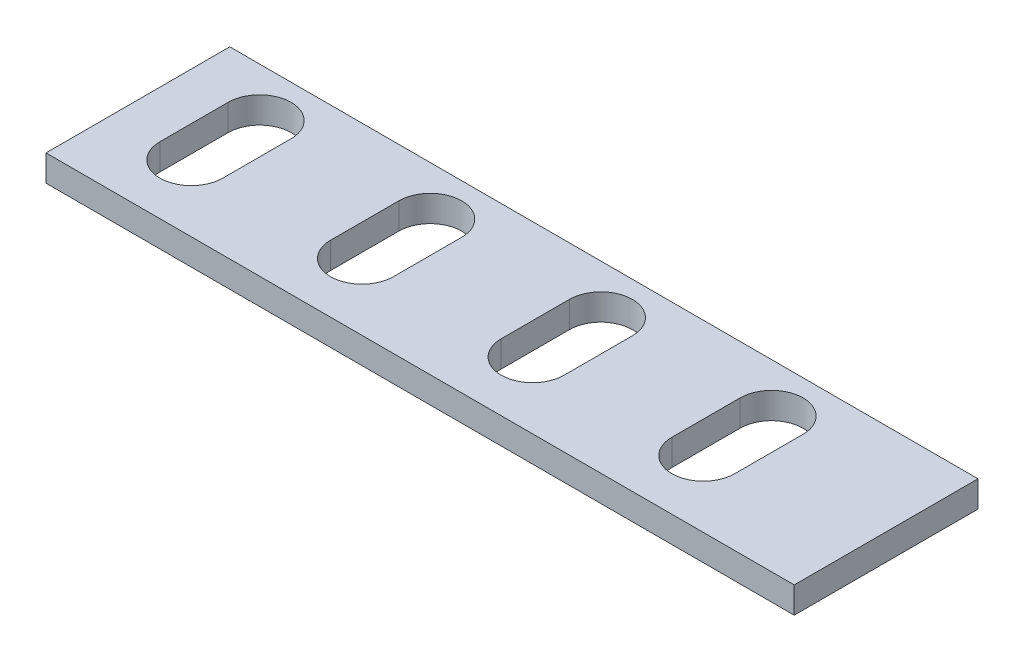
from build123d import *

# Parameters (mm, degrees)
SKETCH1_W           = 570
SKETCH1_H           = 140
BOSS_EXTRUDE1_DEPTH = 20


with BuildPart() as part:
    # Sketch1 → Boss-Extrude1 (new body)
    with BuildSketch(Plane(origin=(0, 0, 0), x_dir=(1, 0, 0), z_dir=(0, 1, 0))):
        with Locations((-36.238685709, 22.089881478)):
            Rectangle(SKETCH1_W, SKETCH1_H)
        with BuildLine():
            Line((-237.238685709, 54.823652517), (-237.238685709, 2.823652517))
            ThreePointArc((-237.238685709, 2.823652517), (-261.238685709, -21.176347483), (-285.238685709, 2.823652517))
            Line((-285.238685709, 2.823652517), (-285.238685709, 54.823652517))
            ThreePointArc((-285.238685709, 54.823652517), (-261.238685709, 78.823652517), (-237.238685709, 54.823652517))
        make_face(mode=Mode.SUBTRACT)
        with BuildLine():
            Line((-107.238685709, 54.823652517), (-107.238685709, 2.823652517))
            ThreePointArc((-107.238685709, 2.823652517), (-131.238685709, -21.176347483), (-155.238685709, 2.823652517))
            Line((-155.238685709, 2.823652517), (-155.238685709, 54.823652517))
            ThreePointArc((-155.238685709, 54.823652517), (-131.238685709, 78.823652517), (-107.238685709, 54.823652517))
        make_face(mode=Mode.SUBTRACT)
        with BuildLine():
            Line((22.761314291, 54.823652517), (22.761314291, 2.823652517))
            ThreePointArc((22.761314291, 2.823652517), (-1.238685709, -21.176347483), (-25.238685709, 2.823652517))
            Line((-25.238685709, 2.823652517), (-25.238685709, 54.823652517))
            ThreePointArc((-25.238685709, 54.823652517), (-1.238685709, 78.823652517), (22.761314291, 54.823652517))
        make_face(mode=Mode.SUBTRACT)
        with BuildLine():
            Line((152.761314291, 54.823652517), (152.761314291, 2.823652517))
            ThreePointArc((152.761314291, 2.823652517), (128.761314291, -21.176347483), (104.761314291, 2.823652517))
            Line((104.761314291, 2.823652517), (104.761314291, 54.823652517))
            ThreePointArc((104.761314291, 54.823652517), (128.761314291, 78.823652517), (152.761314291, 54.823652517))
        make_face(mode=Mode.SUBTRACT)
    extrude(amount=BOSS_EXTRUDE1_DEPTH)


solid = part.part
